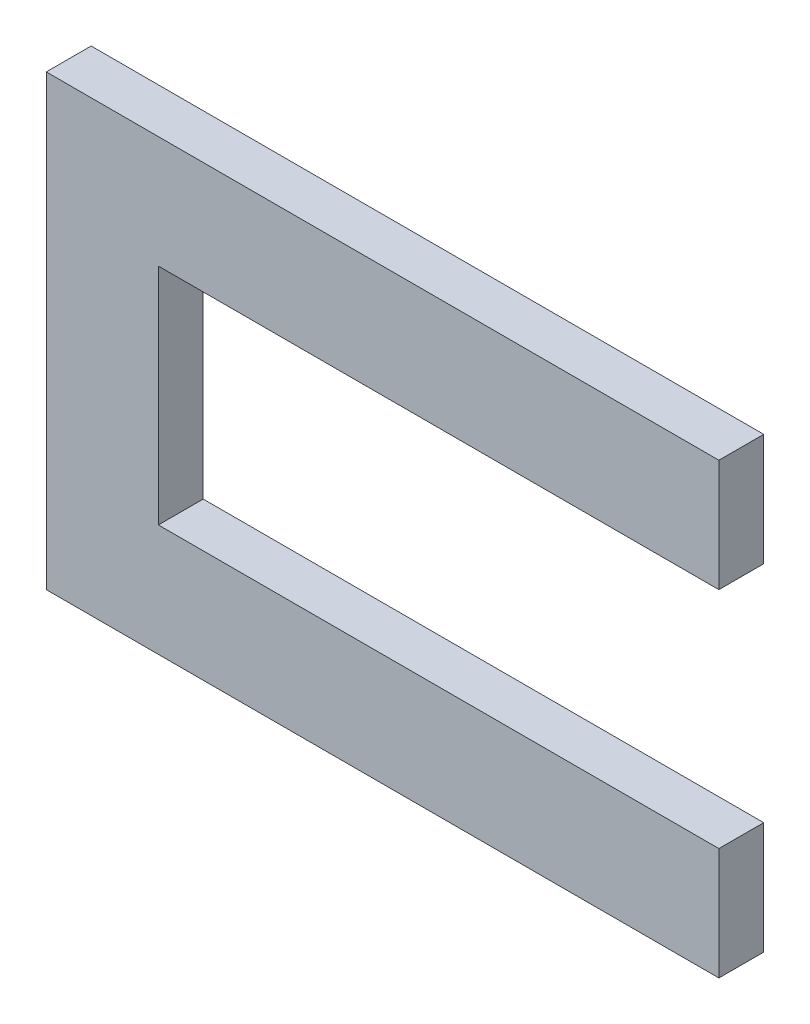
from build123d import *

# Parameters (mm, degrees)
BOSS_EXTRUDE1_DEPTH = 2


with BuildPart() as part:
    # Sketch1 → Boss-Extrude1 (new body)
    with BuildSketch(Plane.XY):
        Polygon((-15, 10), (-15, 0), (-10, 0), (-10, 5), (7.5, 5), (15, 10), align=None)
        Polygon((-7.5, -5), (-15, -10), (15, -10), (15, -5), align=None)
        Polygon((15, 10), (7.5, 5), (15, 5), align=None)
        Polygon((-15, 0), (-15, -10), (-7.5, -5), (-10, -5), (-10, 0), align=None)
    extrude(amount=BOSS_EXTRUDE1_DEPTH)


solid = part.part
